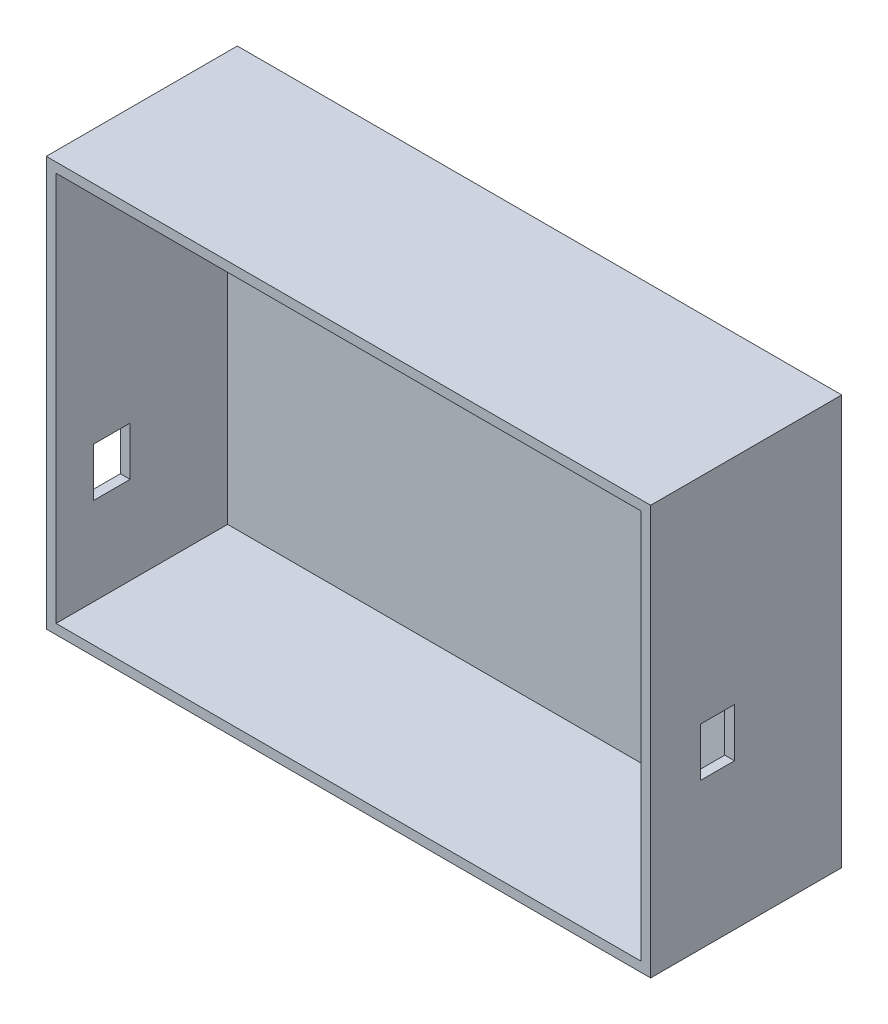
from build123d import *

# Parameters (mm, degrees)
SKETCH1_W           = 157.48
SKETCH1_H           = 106.68
BOSS_EXTRUDE1_DEPTH = 49.784
SKETCH3_W           = 152.4
SKETCH3_H           = 101.6
CUT_EXTRUDE1_DEPTH  = 44.704
SKETCH4_W           = 8.89
SKETCH4_H           = 12.7
CUT_EXTRUDE2_DEPTH  = 43.18
SKETCH6_W           = 9.525
SKETCH6_H           = 12.7
CUT_EXTRUDE3_DEPTH  = 43.18


with BuildPart() as part:
    # Sketch1 → Boss-Extrude1 (new body)
    with BuildSketch(Plane.XY):
        Rectangle(SKETCH1_W, SKETCH1_H)
    extrude(amount=BOSS_EXTRUDE1_DEPTH)

    # Sketch3 → Cut-Extrude1 (cut)
    with BuildSketch(Plane.XY.offset(49.784)):
        Rectangle(SKETCH3_W, SKETCH3_H)
    extrude(amount=-CUT_EXTRUDE1_DEPTH, mode=Mode.SUBTRACT)

    # Sketch4 → Cut-Extrude2 (cut)
    with BuildSketch(Plane(origin=(78.74, 0, 0), x_dir=(0, 0, -1), z_dir=(1, 0, 0))):
        with Locations((-32.385, -8.89)):
            Rectangle(SKETCH4_W, SKETCH4_H)
    extrude(amount=-CUT_EXTRUDE2_DEPTH, mode=Mode.SUBTRACT)

    # Sketch6 → Cut-Extrude3 (cut)
    with BuildSketch(Plane.ZY.offset(78.74)):
        with Locations((35.2425, -21.59)):
            Rectangle(SKETCH6_W, SKETCH6_H)
    extrude(amount=-CUT_EXTRUDE3_DEPTH, mode=Mode.SUBTRACT)


solid = part.part
